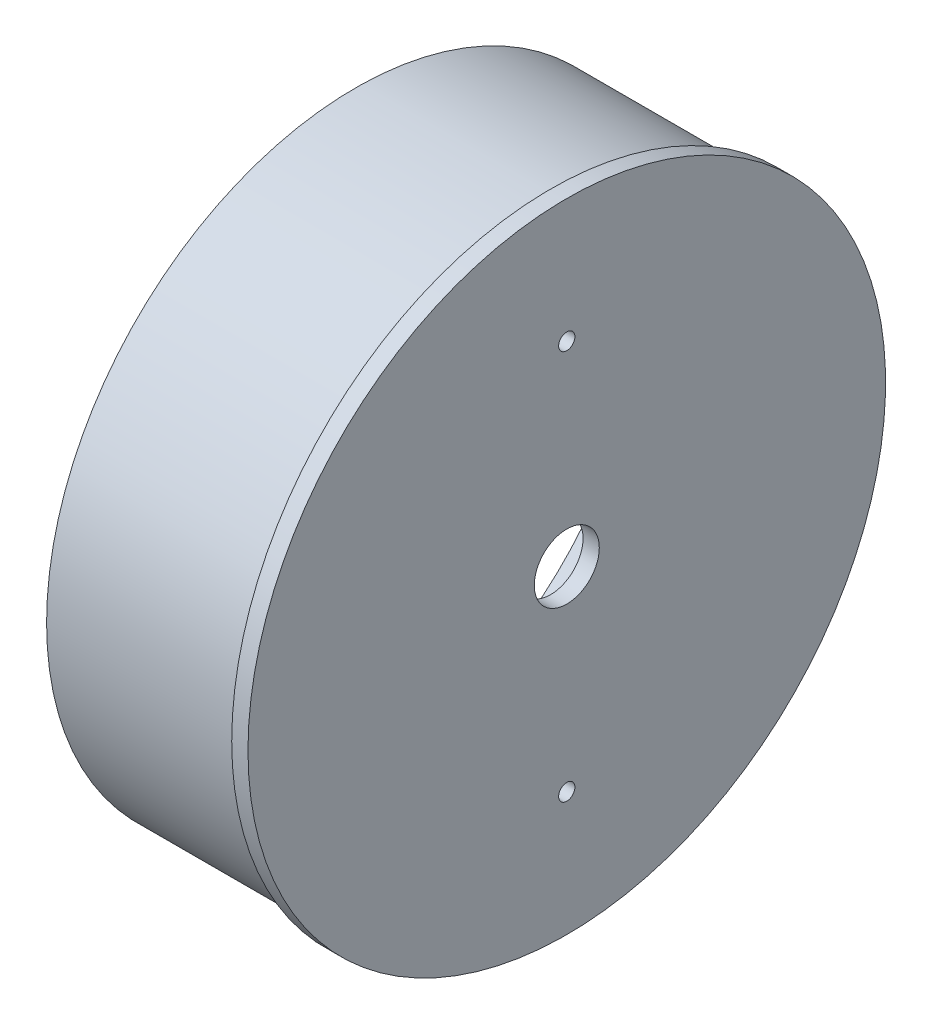
from build123d import *

# Parameters (mm, degrees)
SKETCH1_W          = 2.5
SKETCH1_H          = 49.03
SKETCH1_W_2        = 30
SKETCH1_H_2        = 2.5
CUT_EXTRUDE1_DEPTH = 10


with BuildPart() as part:
    # Sketch1 → Revolve1 (revolve)
    with BuildSketch(Plane.XY, mode=Mode.PRIVATE) as revolve1_sk:
        with Locations((8.376364172, 0.726593752)):
            Rectangle(SKETCH1_W, SKETCH1_H)
        with Locations((-7.873635828, 22.461593752)):
            Rectangle(SKETCH1_W_2, SKETCH1_H_2)
    revolve(revolve1_sk.sketch.rotate(Axis((7.126364172, -23.788406248, 0), (1, 0, 0)), 90), axis=Axis((7.126364172, -23.788406248, 0), (1, 0, 0)))

    # Sketch2 → Cut-Extrude1 (cut)
    with BuildSketch(Plane(origin=(9.626364172, 0, 0), x_dir=(0, 0, -1), z_dir=(1, 0, 0))):
        with BuildLine():
            Line((0, -23.788406248), (0, -18.788406248))
            ThreePointArc((0, -18.788406248), (-5, -23.788406248), (0, -28.788406248))
            Line((0, -28.788406248), (0, -23.788406248))
        make_face()
        with BuildLine():
            ThreePointArc((5, -23.788406248), (3.535533906, -20.252872342), (0, -18.788406248))
            Line((0, -18.788406248), (0, -23.788406248))
            Line((0, -23.788406248), (5, -23.788406248))
        make_face()
        with BuildLine():
            Line((5, -23.788406248), (0, -23.788406248))
            Line((0, -23.788406248), (0, -28.788406248))
            ThreePointArc((0, -28.788406248), (3.535533906, -27.323940154), (5, -23.788406248))
        make_face()
        with BuildLine():
            ThreePointArc((1.25, -53.788406248), (0.883883476, -52.904522772), (0, -52.538406248))
            Line((0, -52.538406248), (0, -55.038406248))
            ThreePointArc((0, -55.038406248), (0.883883476, -54.672289725), (1.25, -53.788406248))
        make_face()
        with BuildLine():
            Line((0, -55.038406248), (0, -52.538406248))
            ThreePointArc((0, -52.538406248), (-1.25, -53.788406248), (0, -55.038406248))
        make_face()
        with BuildLine():
            ThreePointArc((1.25, 6.211593752), (0.883883476, 7.095477228), (0, 7.461593752))
            Line((0, 7.461593752), (0, 4.961593752))
            ThreePointArc((0, 4.961593752), (0.883883476, 5.327710275), (1.25, 6.211593752))
        make_face()
        with BuildLine():
            Line((0, 4.961593752), (0, 7.461593752))
            ThreePointArc((0, 7.461593752), (-1.25, 6.211593752), (0, 4.961593752))
        make_face()
    extrude(amount=-CUT_EXTRUDE1_DEPTH, mode=Mode.SUBTRACT)


solid = part.part
